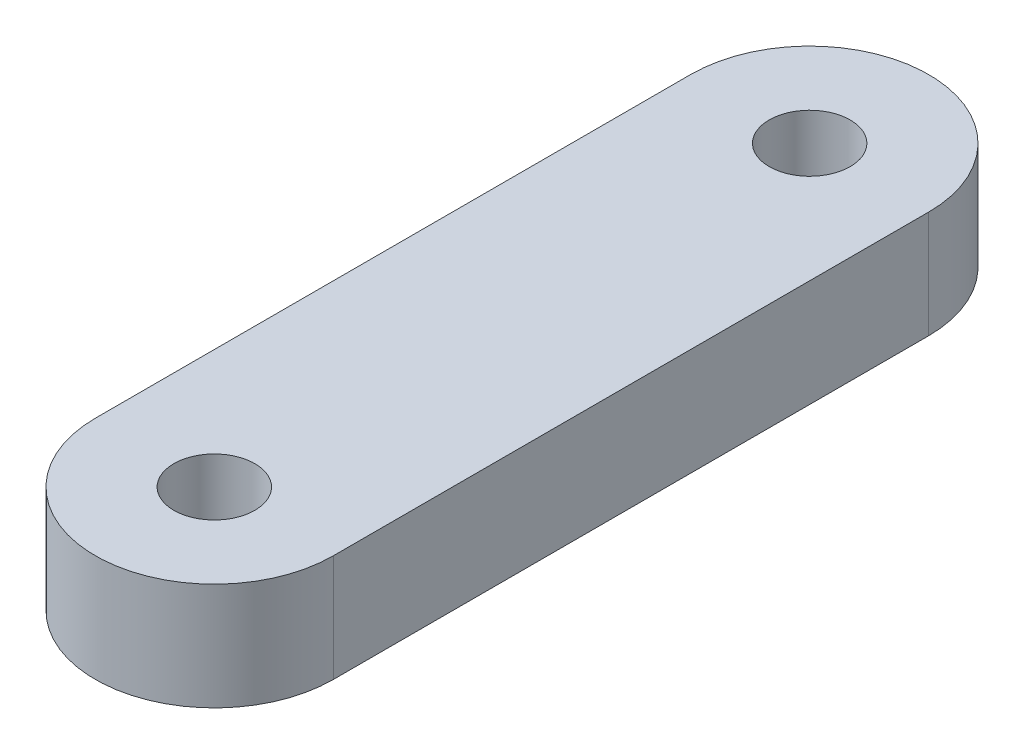
from build123d import *

# Parameters (mm, degrees)
SKETCH1_R           = 1.7
BOSS_EXTRUDE1_DEPTH = 4.5


with BuildPart() as part:
    # Sketch1 → Boss-Extrude1 (new body)
    with BuildSketch(Plane(origin=(0, 0, 0), x_dir=(1, 0, 0), z_dir=(0, 1, 0))):
        with BuildLine():
            Line((-5, 0), (-5, 25))
            ThreePointArc((-5, 25), (0, 30), (5, 25))
            Line((5, 25), (5, 0))
            ThreePointArc((5, 0), (0, -5), (-5, 0))
        make_face()
        with Locations(Location((0, 0, 0), (0, 0, 270))):
            Circle(SKETCH1_R, mode=Mode.SUBTRACT)
        with Locations(Location((0, 25, 0), (0, 0, 270))):
            Circle(SKETCH1_R, mode=Mode.SUBTRACT)
    extrude(amount=BOSS_EXTRUDE1_DEPTH)


solid = part.part
